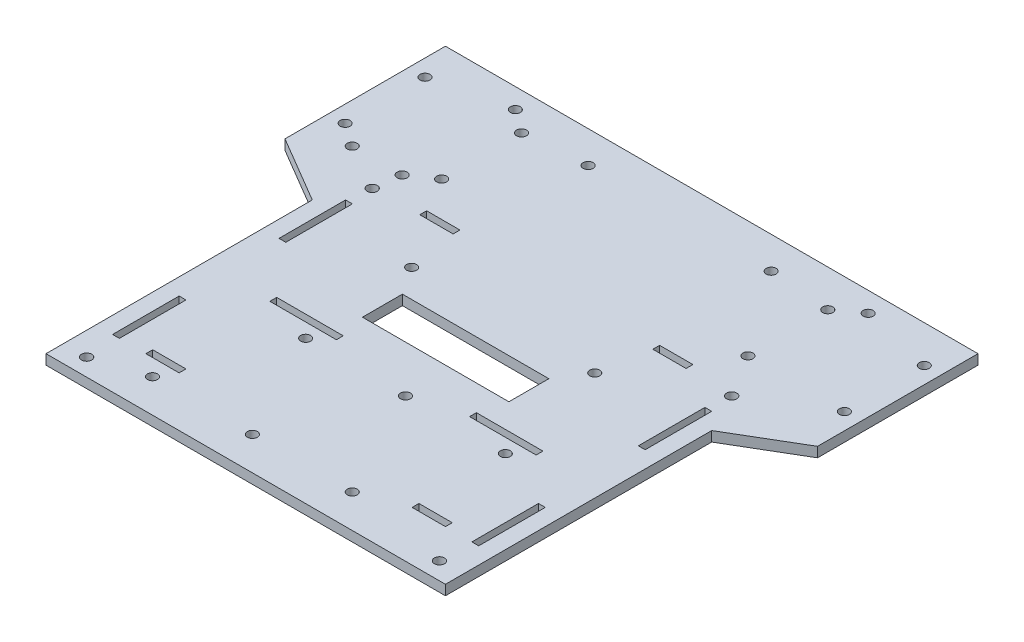
from build123d import *

# Parameters (mm, degrees)
BOSS_EXTRUDE1_DEPTH = 3
SKETCH2_R           = 1.5
CUT_EXTRUDE1_DEPTH  = 107.343782141
SKETCH3_2_R         = 1.5
CUT_EXTRUDE3_DEPTH  = 107.343782141
SKETCH4_R           = 1.5
CUT_EXTRUDE4_DEPTH  = 107.343782141
SKETCH5_R           = 1.5
CUT_EXTRUDE5_DEPTH  = 3
SKETCH6_R           = 1.525
SKETCH6_W           = 10
SKETCH6_H           = 2.05
SKETCH6_W_2         = 20
CUT_EXTRUDE7_DEPTH  = 107.343782141
SKETCH9_R           = 1.525
CUT_EXTRUDE8_DEPTH  = 3
SKETCH10_W          = 44
SKETCH10_H          = 12
CUT_EXTRUDE9_DEPTH  = 5
SKETCH11_R          = 1.5
CUT_EXTRUDE10_DEPTH = 5
SKETCH12_W          = 2.05
SKETCH12_H          = 20
CUT_EXTRUDE11_DEPTH = 10


with BuildPart() as part:
    # Sketch1 → Boss-Extrude1 (new body)
    with BuildSketch(Plane(origin=(0, 0, 0), x_dir=(1, 0, 0), z_dir=(0, 1, 0))):
        Polygon((-80, 70), (-80, 21.791828604), (-60, 10), (-60, -70), (60, -70), (60, 10), (80, 21.791828604), (80, 70), align=None)
    extrude(amount=BOSS_EXTRUDE1_DEPTH)

    # Sketch2 → Cut-Extrude1 (cut, through all)
    with BuildSketch(Plane(origin=(0, 3, 0), x_dir=(1, 0, 0), z_dir=(0, 1, 0))):
        with Locations((-38, -60)):
            Circle(SKETCH2_R)
        with Locations((-25, -27)):
            Circle(SKETCH2_R)
        with Locations((5, -27)):
            Circle(SKETCH2_R)
        with Locations((-8, -60)):
            Circle(SKETCH2_R)
        with Locations((35, -27)):
            Circle(SKETCH2_R)
        with Locations((22, -60)):
            Circle(SKETCH2_R)
    extrude(amount=-CUT_EXTRUDE1_DEPTH, mode=Mode.SUBTRACT)

    # Sketch3<2> → Cut-Extrude3 (cut, through all)
    with BuildSketch(Plane(origin=(0, 3, 0), x_dir=(1, 0, 0), z_dir=(0, 1, 0))):
        with Locations((-27.529579069, 60.385555627)):
            Circle(SKETCH3_2_R)
        with Locations((-27.529579069, 7.385555627)):
            Circle(SKETCH3_2_R)
        with Locations((27.470420931, 7.385555627)):
            Circle(SKETCH3_2_R)
        with Locations((27.470420931, 60.385555627)):
            Circle(SKETCH3_2_R)
    extrude(amount=-CUT_EXTRUDE3_DEPTH, mode=Mode.SUBTRACT)

    # Sketch4 → Cut-Extrude4 (cut, through all)
    with BuildSketch(Plane(origin=(0, 3, 0), x_dir=(1, 0, 0), z_dir=(0, 1, 0))):
        with Locations((-75, 34.863883517)):
            Circle(SKETCH4_R)
        with Locations((-75, 58.863883517)):
            Circle(SKETCH4_R)
        with Locations((-46, 34.863883517)):
            Circle(SKETCH4_R)
        with Locations((-46, 58.863883517)):
            Circle(SKETCH4_R)
        with Locations((46, 58.863883517)):
            Circle(SKETCH4_R)
        with Locations((46, 34.863883517)):
            Circle(SKETCH4_R)
        with Locations((75, 34.863883517)):
            Circle(SKETCH4_R)
        with Locations((75, 58.863883517)):
            Circle(SKETCH4_R)
    extrude(amount=-CUT_EXTRUDE4_DEPTH, mode=Mode.SUBTRACT)

    # Sketch5 → Cut-Extrude5 (cut)
    with BuildSketch(Plane(origin=(0, 3, 0), x_dir=(1, 0, 0), z_dir=(0, 1, 0))):
        with Locations((-68, 30)):
            Circle(SKETCH5_R)
        with Locations((-53, 30)):
            Circle(SKETCH5_R)
    extrude(amount=-CUT_EXTRUDE5_DEPTH, mode=Mode.SUBTRACT)

    # Sketch6 → Cut-Extrude7 (cut, through all)
    with BuildSketch(Plane(origin=(0, 3, 0), x_dir=(1, 0, 0), z_dir=(0, 1, 0))):
        with Locations((-53, -64.8)):
            Circle(SKETCH6_R)
        with Locations((53, -64.8)):
            Circle(SKETCH6_R)
        with Locations((-40, -53.975)):
            Rectangle(SKETCH6_W, SKETCH6_H)
        with Locations((40, -53.975)):
            Rectangle(SKETCH6_W, SKETCH6_H)
        with Locations((30, -21.725)):
            Rectangle(SKETCH6_W_2, SKETCH6_H)
        with Locations((-30, -21.725)):
            Rectangle(SKETCH6_W_2, SKETCH6_H)
        with Locations((35, 23.325)):
            Rectangle(SKETCH6_W, SKETCH6_H)
        with Locations((-35, 23.325)):
            Rectangle(SKETCH6_W, SKETCH6_H)
    extrude(amount=-CUT_EXTRUDE7_DEPTH, mode=Mode.SUBTRACT)

    # Sketch9 → Cut-Extrude8 (cut)
    with BuildSketch(Plane(origin=(0, 3, 0), x_dir=(1, 0, 0), z_dir=(0, 1, 0))):
        with Locations((-54, 22)):
            Circle(SKETCH9_R)
        with Locations((54, 22)):
            Circle(SKETCH9_R)
    extrude(amount=-CUT_EXTRUDE8_DEPTH, mode=Mode.SUBTRACT)

    # Sketch10 → Cut-Extrude9 (cut)
    with BuildSketch(Plane(origin=(0, 3, 0), x_dir=(1, 0, 0), z_dir=(0, 1, 0))):
        with Locations((0.046472237, -6.975074484)):
            Rectangle(SKETCH10_W, SKETCH10_H)
    extrude(amount=-CUT_EXTRUDE9_DEPTH, mode=Mode.SUBTRACT)

    # Sketch11 → Cut-Extrude10 (cut)
    with BuildSketch(Plane(origin=(0, 3, 0), x_dir=(1, 0, 0), z_dir=(0, 1, 0))):
        with Locations((-53, 64)):
            Circle(SKETCH11_R)
        with Locations((53, 64)):
            Circle(SKETCH11_R)
    extrude(amount=-CUT_EXTRUDE10_DEPTH, mode=Mode.SUBTRACT)

    # Sketch12 → Cut-Extrude11 (cut)
    with BuildSketch(Plane(origin=(0, 3, 0), x_dir=(1, 0, 0), z_dir=(0, 1, 0))):
        with Locations((-53.975, 5)):
            Rectangle(SKETCH12_W, SKETCH12_H)
        with Locations((-53.975, -45)):
            Rectangle(SKETCH12_W, SKETCH12_H)
        with Locations((53.975, -45)):
            Rectangle(SKETCH12_W, SKETCH12_H)
        with Locations((53.975, 5)):
            Rectangle(SKETCH12_W, SKETCH12_H)
    extrude(amount=-CUT_EXTRUDE11_DEPTH, mode=Mode.SUBTRACT)


solid = part.part
